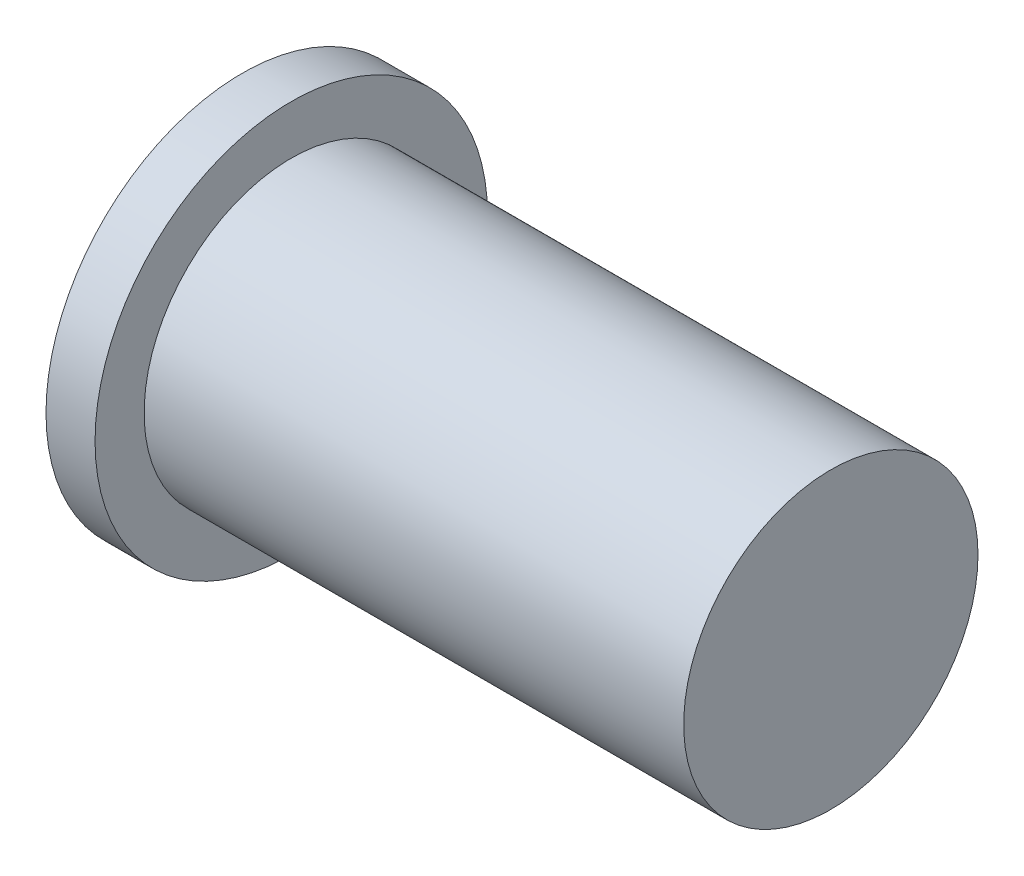
from build123d import *

# Parameters (mm, degrees)
SKETCH1_R           = 4
SKETCH1_R_2         = 3
BOSS_EXTRUDE1_DEPTH = 1
SKETCH1_2_R         = 3
BOSS_EXTRUDE2_DEPTH = 12


with BuildPart() as part:
    # Sketch1 → Boss-Extrude1 (new body)
    with BuildSketch(Plane(origin=(0, 0, 0), x_dir=(0, 0, -1), z_dir=(1, 0, 0))):
        with Locations((0.107705652, 0)):
            Circle(SKETCH1_R)
        with Locations((0.107705652, 0)):
            Circle(SKETCH1_R_2, mode=Mode.SUBTRACT)
    extrude(amount=BOSS_EXTRUDE1_DEPTH)

    # Sketch1<2> → Boss-Extrude2 (add)
    with BuildSketch(Plane(origin=(0, 0, 0), x_dir=(0, 0, -1), z_dir=(1, 0, 0))):
        with Locations((0.107705652, 0)):
            Circle(SKETCH1_2_R)
    extrude(amount=BOSS_EXTRUDE2_DEPTH)


solid = part.part
